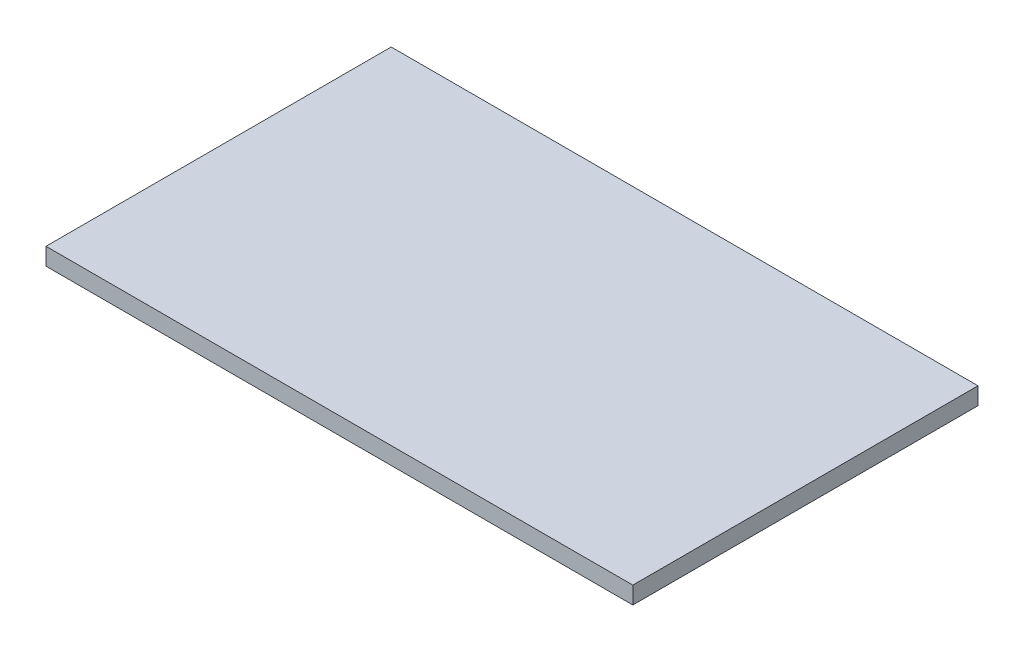
from build123d import *

# Parameters (mm, degrees)
SKETCH1_W           = 431.8
SKETCH1_H           = 254
BOSS_EXTRUDE1_DEPTH = 12.7


with BuildPart() as part:
    # Sketch1 → Boss-Extrude1 (new body)
    with BuildSketch(Plane(origin=(0, 0, 0), x_dir=(1, 0, 0), z_dir=(0, 1, 0))):
        with Locations((215.9, 127)):
            Rectangle(SKETCH1_W, SKETCH1_H)
    extrude(amount=BOSS_EXTRUDE1_DEPTH)


solid = part.part
